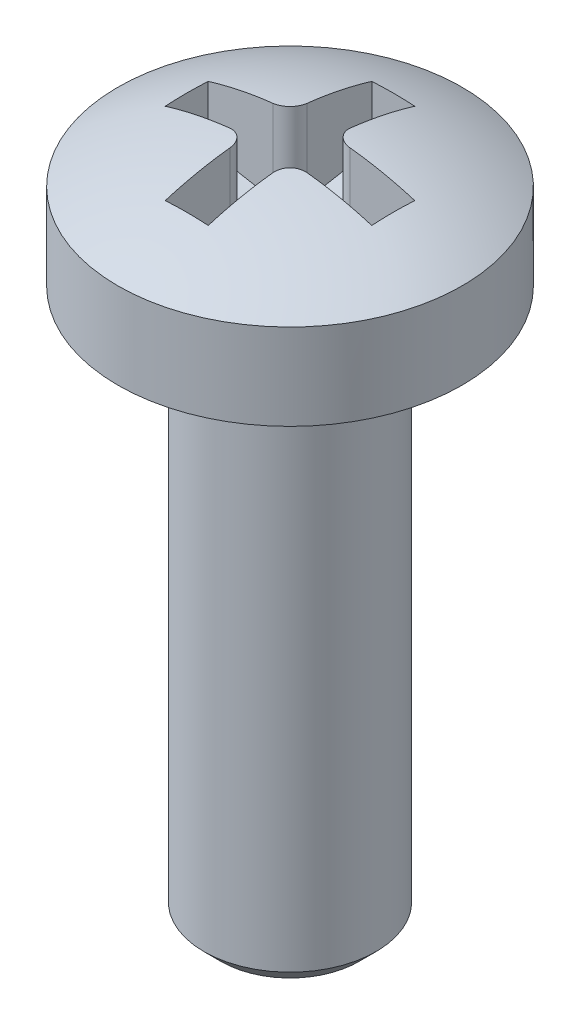
from build123d import *

# Parameters (mm, degrees)
CUT_EXTRUDE1_REACH      = 39.493
CUT_EXTRUDE1_END_RADIUS = 10.625
CUT_EXTRUDE1_START      = 20
FILLET1_R               = 0.5
CHAMFER1_SIZE           = 0.5


with BuildPart() as part:
    # Sketch1 → Revolve1 (revolve)
    with BuildSketch(Plane.XY, mode=Mode.PRIVATE) as revolve1_sk:
        with BuildLine():
            Line((0, 0), (0, 3.8))
            ThreePointArc((0, 3.8), (2.583118271, 3.469685656), (5, 2.5))
            Line((5, 2.5), (5, 0))
            Line((5, 0), (2.5, 0))
            Line((2.5, 0), (2.5, -16))
            Line((2.5, -16), (0, -16))
            Line((0, -16), (0, 0))
        make_face()
    revolve(revolve1_sk.sketch.rotate(Axis((0, 3.8, 0), (0, -1, 0)), 90), axis=Axis((0, 3.8, 0), (0, -1, 0)))

    # Cut-Extrude1: up to this sphere (the profile starts inside it)
    cut_extrude1_end = Location((0, 11.875, 0)) * Sphere(CUT_EXTRUDE1_END_RADIUS, mode=Mode.PRIVATE)
    # Sketch4 → Cut-Extrude1 (cut, up to the surface)
    with BuildSketch(Plane(origin=(0, 0, 0), x_dir=(1, 0, 0), z_dir=(0, 1, 0)).offset(CUT_EXTRUDE1_START), mode=Mode.PRIVATE) as cut_extrude1_sk1:
        Polygon((-0.625, -0.625), (-0.625, -3), (0.625, -3), (0.625, -0.625), (3, -0.625), (3, 0.625), (0.625, 0.625), (0.625, 3), (-0.625, 3), (-0.625, 0.625), (-3, 0.625), (-3, -0.625), align=None)
    cut_extrude1_tool1 = extrude(cut_extrude1_sk1.sketch, amount=-CUT_EXTRUDE1_REACH, mode=Mode.PRIVATE) & cut_extrude1_end
    add(cut_extrude1_tool1.solids().sort_by_distance((0, 20, 0))[0], mode=Mode.SUBTRACT)

    # Fillet1
    fillet1_edges = [part.edges().sort_by_distance(p)[0] for p in [
        (0.625, 2.524352551, 0.625),
        (-0.625, 2.524352551, 0.625),
        (-0.625, 2.524352551, -0.625),
        (0.625, 2.524352551, -0.625),
    ]]
    fillet(fillet1_edges, radius=FILLET1_R)

    # Chamfer1
    chamfer1_edges = [part.edges().sort_by_distance(p)[0] for p in [
        (0, -16, -2.5),
    ]]
    chamfer(chamfer1_edges, length=CHAMFER1_SIZE)


solid = part.part
